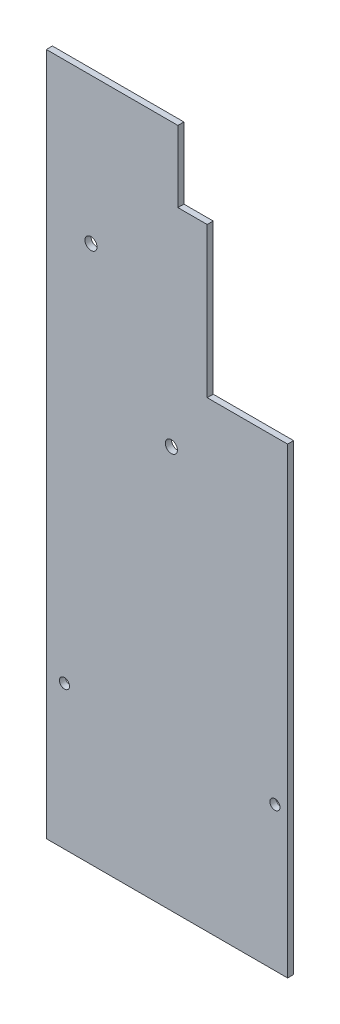
from build123d import *

# Parameters (mm, degrees)
RESSALTO_EXTRUS_O1_DEPTH                   = 1.5
CORTE_EXTRUS_O2_REACH                      = 167.453
ESBO_O5_R                                  = 1.5
BROCA_DE_ROSQUEAR_PARA_TARRAXA_DE_M3X0_5_D = 2.5
CORTE_EXTRUS_O3_REACH                      = 167.453
ESBO_O15_R                                 = 1.5
CORTE_EXTRUS_O4_REACH                      = 167.453
ESBO_O16_W                                 = 7.289764361
ESBO_O16_H                                 = 17.697498775


with BuildPart() as part:
    # Esboço2 → Ressalto-extrusão1 (new body)
    with BuildSketch(Plane(origin=(0, 0, 25.401562241), x_dir=(-1, 0, 0), z_dir=(0, 0, -1))):
        Polygon((40, 9.462441068), (0, 9.462441068), (0, -45.537558932), (-20, -45.537558932), (-20, -160.537558932), (40, -160.537558932), align=None)
    extrude(amount=RESSALTO_EXTRUS_O1_DEPTH)

    # Esboço5 → Corte-extrusão2 (cut, up to next)
    with BuildSketch(Plane(origin=(0, 0, 23.901562241), x_dir=(-1, 0, 0), z_dir=(0, 0, -1)), mode=Mode.PRIVATE) as corte_extrus_o2_sk1:
        with Locations((28.9, -26.787558932)):
            Circle(ESBO_O5_R)
    corte_extrus_o2_tool1 = extrude(corte_extrus_o2_sk1.sketch, amount=-CORTE_EXTRUS_O2_REACH, mode=Mode.PRIVATE) & part.part
    add(corte_extrus_o2_tool1.solids().sort_by_distance((-28.9, -26.787559, 23.901562))[0], mode=Mode.SUBTRACT)

    # Broca de rosquear para tarraxa de M3x0.52 (through all)
    with Locations(Plane(origin=(0, 0, 23.901562241), x_dir=(-1, 0, 0), z_dir=(0, 0, -1))):
        with Locations((-16.849169709, -124.734682683), (35.5, -124.808922584)):
            Hole(BROCA_DE_ROSQUEAR_PARA_TARRAXA_DE_M3X0_5_D / 2)

    # Esboço15 → Corte-extrusão3 (cut, up to next)
    with BuildSketch(Plane(origin=(0, 0, 23.901562241), x_dir=(-1, 0, 0), z_dir=(0, 0, -1)), mode=Mode.PRIVATE) as corte_extrus_o3_sk1:
        with Locations((8.9, -60.537558932)):
            Circle(ESBO_O15_R)
    corte_extrus_o3_tool1 = extrude(corte_extrus_o3_sk1.sketch, amount=-CORTE_EXTRUS_O3_REACH, mode=Mode.PRIVATE) & part.part
    add(corte_extrus_o3_tool1.solids().sort_by_distance((-8.9, -60.537559, 23.901562))[0], mode=Mode.SUBTRACT)

    # Esboço16 → Corte-extrusão4 (cut, up to next)
    with BuildSketch(Plane(origin=(0, 0, 23.901562241), x_dir=(-1, 0, 0), z_dir=(0, 0, -1)), mode=Mode.PRIVATE) as corte_extrus_o4_sk1:
        with Locations((3.644882181, 0.61369168)):
            Rectangle(ESBO_O16_W, ESBO_O16_H)
    corte_extrus_o4_tool1 = extrude(corte_extrus_o4_sk1.sketch, amount=-CORTE_EXTRUS_O4_REACH, mode=Mode.PRIVATE) & part.part
    add(corte_extrus_o4_tool1.solids().sort_by_distance((-3.644882, 0.613692, 23.901562))[0], mode=Mode.SUBTRACT)


solid = part.part
